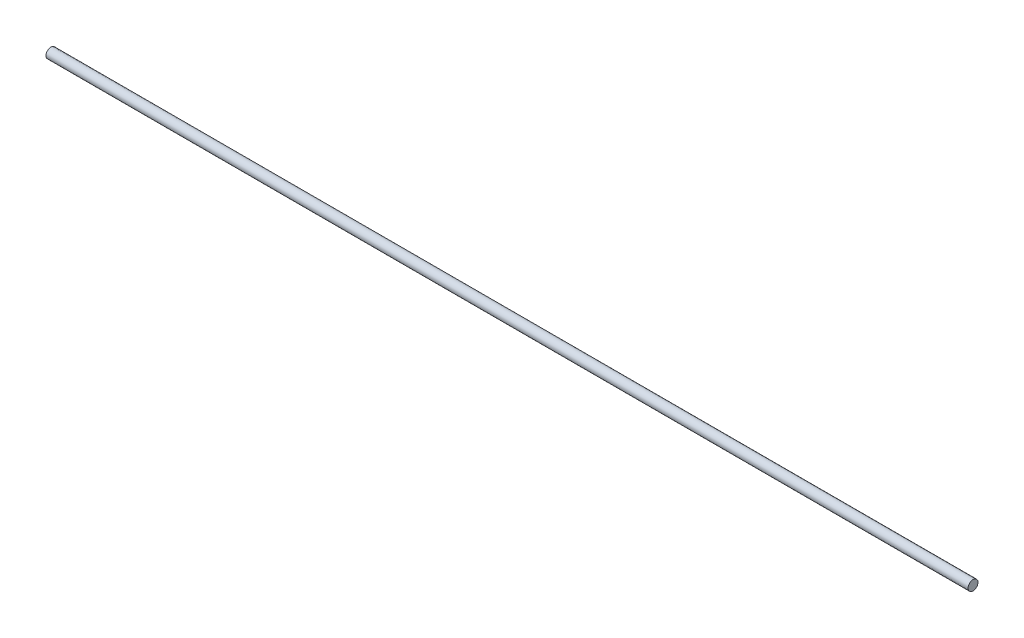
from build123d import *

# Parameters (mm, degrees)
SKETCH1_R           = 4
BOSS_EXTRUDE1_DEPTH = 746


with BuildPart() as part:
    # Sketch1 → Boss-Extrude1 (new body)
    with BuildSketch(Plane(origin=(0, 0, 0), x_dir=(0, 0, -1), z_dir=(1, 0, 0))):
        Circle(SKETCH1_R)
    extrude(amount=BOSS_EXTRUDE1_DEPTH)


solid = part.part
